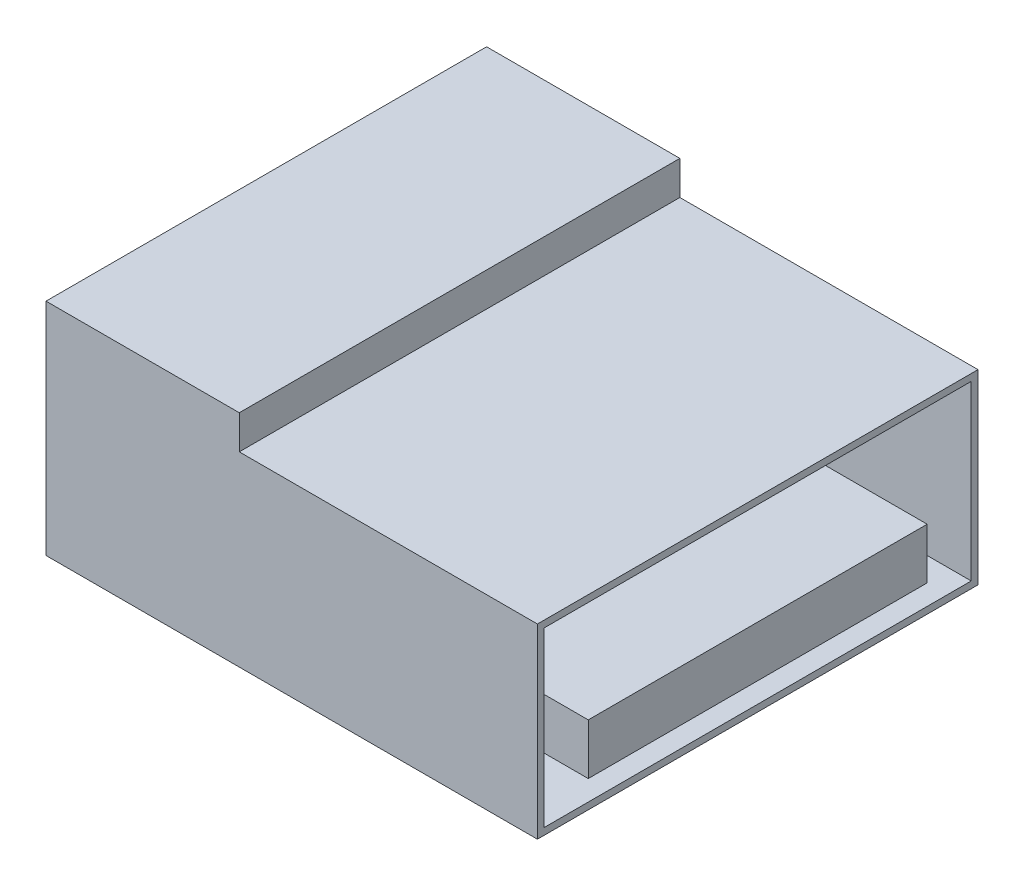
from build123d import *

# Parameters (mm, degrees)
SKETCH_1_W          = 14.5
SKETCH_1_H          = 13
EXTRUDE_1_DEPTH     = 5.5
SKETCH_2_W          = 5.703148186
SKETCH_2_H          = 13
EXTRUDE_2_DEPTH     = 1
SKETCH_3_W          = 12.6
SKETCH_3_H          = 5.1
CUT_EXTRUDE_1_DEPTH = 9.5
SKETCH_4_W          = 10
SKETCH_4_H          = 1.5
EXTRUDE_3_DEPTH     = 9.5


with BuildPart() as part:
    # 草图1 → 凸台-拉伸1 (new body)
    with BuildSketch(Plane(origin=(0, 0, 0), x_dir=(1, 0, 0), z_dir=(0, 1, 0))):
        with Locations((-1.331183612, -2.01138088)):
            Rectangle(SKETCH_1_W, SKETCH_1_H)
    extrude(amount=EXTRUDE_1_DEPTH)

    # 草图2 → 凸台-拉伸2 (add)
    with BuildSketch(Plane(origin=(0, 5.5, 0), x_dir=(1, 0, 0), z_dir=(0, 1, 0))):
        with Locations((-5.729609519, -2.01138088)):
            Rectangle(SKETCH_2_W, SKETCH_2_H)
    extrude(amount=EXTRUDE_2_DEPTH)

    # 草图3 → 切除-拉伸1 (cut)
    with BuildSketch(Plane(origin=(5.918816388, 0, 0), x_dir=(0, 0, -1), z_dir=(1, 0, 0))):
        with Locations((-2.01138088, 2.75)):
            Rectangle(SKETCH_3_W, SKETCH_3_H)
    extrude(amount=-CUT_EXTRUDE_1_DEPTH, mode=Mode.SUBTRACT)

    # 草图4 → 凸台-拉伸3 (add)
    with BuildSketch(Plane(origin=(-3.581183612, 0, 0), x_dir=(0, 0, -1), z_dir=(1, 0, 0))):
        with Locations((-2.01138088, 1.55)):
            Rectangle(SKETCH_4_W, SKETCH_4_H)
    extrude(amount=EXTRUDE_3_DEPTH)


solid = part.part
